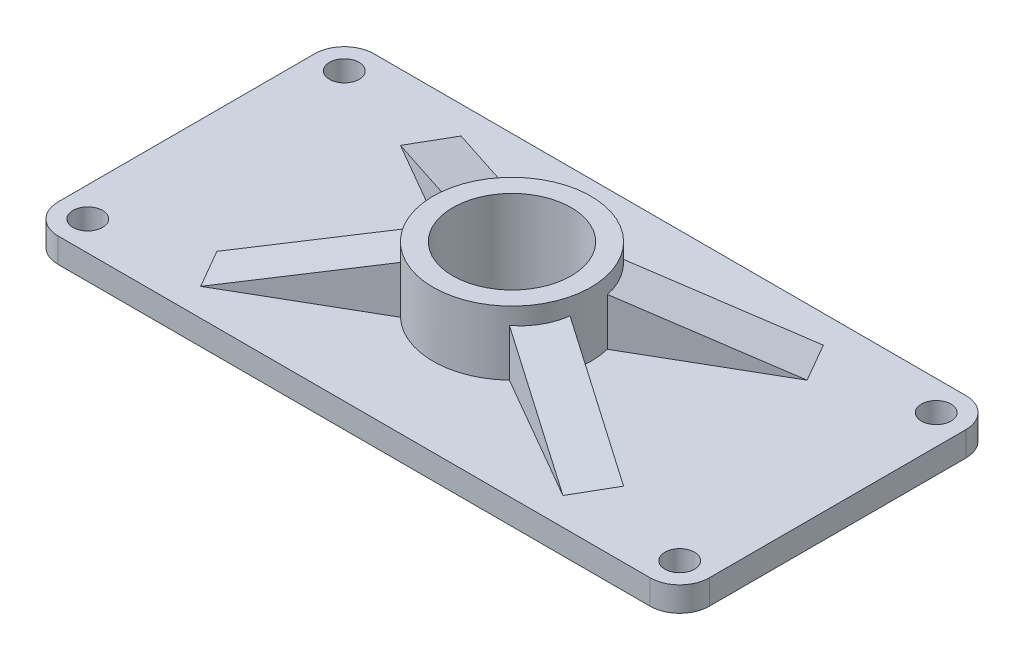
from build123d import *

# Parameters (mm, degrees)
SKETCH1_R           = 3
SKETCH1_R_2         = 16
BOSS_EXTRUDE1_DEPTH = 5
SKETCH1_3_R         = 16
SKETCH1_3_R_2       = 12
BOSS_EXTRUDE2_DEPTH = 18
BOSS_EXTRUDE3_DEPTH = 4.5


with BuildPart() as part:
    # Sketch1 → Boss-Extrude1 (new body)
    with BuildSketch(Plane(origin=(0, 0, 0), x_dir=(1, 0, 0), z_dir=(0, 1, 0))):
        with BuildLine():
            Line((-60, -32), (60, -32))
            ThreePointArc((60, -32), (64.242640687, -30.242640687), (66, -26))
            Line((66, -26), (66, 26))
            ThreePointArc((66, 26), (64.242640687, 30.242640687), (60, 32))
            Line((60, 32), (-60, 32))
            ThreePointArc((-60, 32), (-64.242640687, 30.242640687), (-66, 26))
            Line((-66, 26), (-66, -26))
            ThreePointArc((-66, -26), (-64.242640687, -30.242640687), (-60, -32))
        make_face()
        with Locations((-60, -26)):
            Circle(SKETCH1_R, mode=Mode.SUBTRACT)
        with Locations((60, -26)):
            Circle(SKETCH1_R, mode=Mode.SUBTRACT)
        Circle(SKETCH1_R_2, mode=Mode.SUBTRACT)
        with Locations((-60, 26)):
            Circle(SKETCH1_R, mode=Mode.SUBTRACT)
        with Locations((60, 26)):
            Circle(SKETCH1_R, mode=Mode.SUBTRACT)
    extrude(amount=BOSS_EXTRUDE1_DEPTH)

    # Sketch1<3> → Boss-Extrude2 (add)
    with BuildSketch(Plane(origin=(0, 0, 0), x_dir=(1, 0, 0), z_dir=(0, 1, 0))):
        Circle(SKETCH1_3_R)
        Circle(SKETCH1_3_R_2, mode=Mode.SUBTRACT)
    extrude(amount=BOSS_EXTRUDE2_DEPTH)

    # Sketch3 → Boss-Extrude3 (add, symmetric)
    with BuildSketch(Plane(origin=(0, 0, 0), x_dir=(-0.8660254037844418, 0, -0.4999999999999947), z_dir=(0.4999999999999947, 0, -0.8660254037844418))):
        Polygon((12, 15.722349976), (45, 5), (12, 5), align=None)
        Polygon((-45, 5), (-12, 5), (-12, 15.722349976), align=None)
    boss_extrude3 = extrude(amount=BOSS_EXTRUDE3_DEPTH, both=True)

    # Mirror1: Boss-Extrude3 across plane
    add(boss_extrude3.mirror(Plane.XY))


solid = part.part
